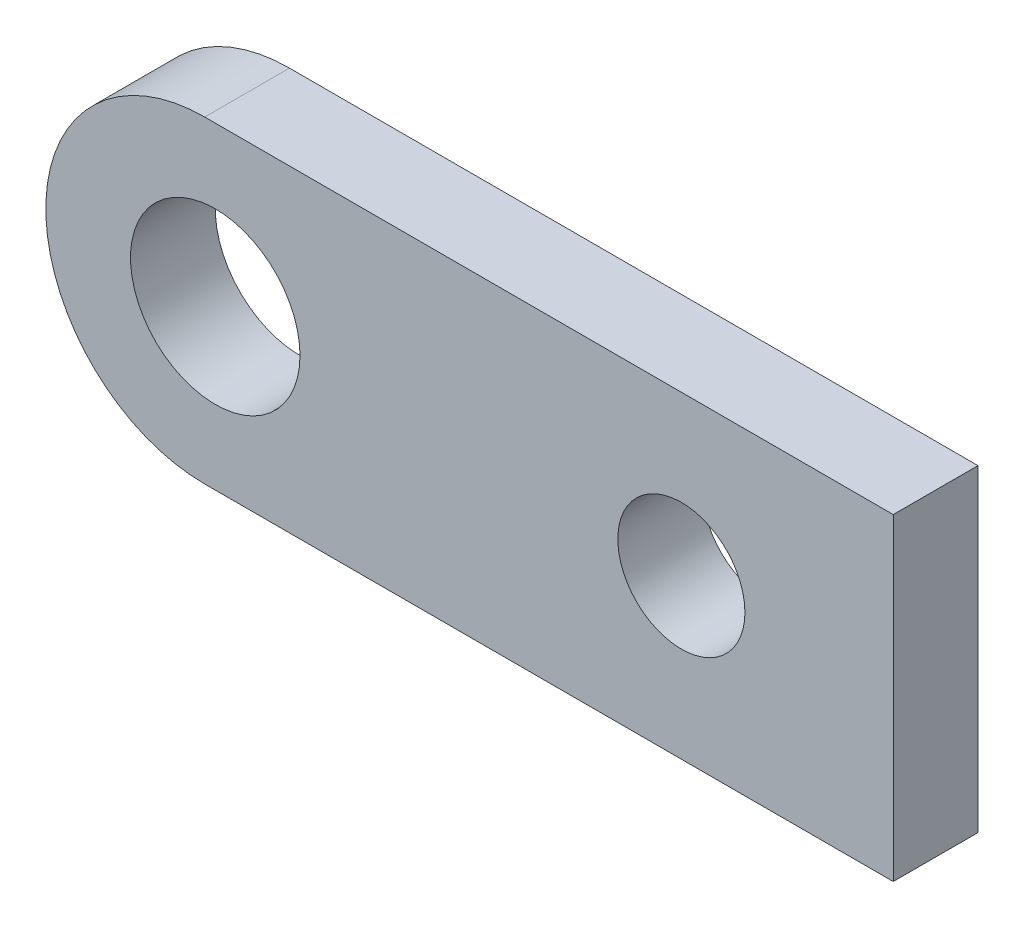
from build123d import *

# Parameters (mm, degrees)
SKETCH_1_R      = 4
SKETCH_1_R_2    = 3
EXTRUDE_1_DEPTH = 4


with BuildPart() as part:
    # Эскиз1 → Бобышка-Вытянуть1 (new body)
    with BuildSketch(Plane.XY):
        with BuildLine():
            Line((7.503245675, 0), (40, 0))
            Line((40, 0), (40, 15))
            Line((40, 15), (7.503245675, 15))
            ThreePointArc((7.503245675, 15), (0.003245675, 7.5), (7.503245675, 0))
        make_face()
        with Locations((8, 7.5)):
            Circle(SKETCH_1_R, mode=Mode.SUBTRACT)
        with Locations((30, 7.5)):
            Circle(SKETCH_1_R_2, mode=Mode.SUBTRACT)
    extrude(amount=EXTRUDE_1_DEPTH)


solid = part.part
